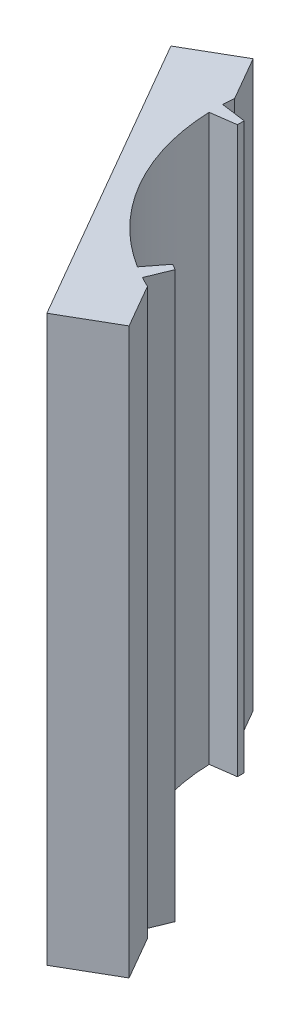
from build123d import *

# Parameters (mm, degrees)
BOSS_EXTRUDE1_DEPTH = 50


with BuildPart() as part:
    # Sketch1 → Boss-Extrude1 (new body)
    with BuildSketch(Plane(origin=(0, 0, 0), x_dir=(1, 0, 0), z_dir=(0, 1, 0))):
        with BuildLine():
            Line((-16.188252967, -0.3), (-16.188252967, 0.3))
            Line((-16.188252967, 0.3), (-18.390214789, 0.6))
            ThreePointArc((-18.390214789, 0.6), (-18.366950287, 1.102332591), (-18.329967032, 1.603841822))
            Line((-18.329967032, 1.603841822), (-20.552991394, 5.454232962))
            Line((-20.552991394, 5.454232962), (-25.166918237, 2.790381057))
            Line((-25.166918237, 2.790381057), (-10.166918237, -23.190381057))
            Line((-10.166918237, -23.190381057), (-5.552991394, -20.526529152))
            Line((-5.552991394, -20.526529152), (-7.776015755, -16.676138011))
            ThreePointArc((-7.776015755, -16.676138011), (-8.228827116, -16.457411834), (-8.675492152, -16.226393189))
            Line((-8.675492152, -16.226393189), (-7.834318863, -14.169438313))
            Line((-7.834318863, -14.169438313), (-8.353934105, -13.869438313))
            Line((-8.353934105, -13.869438313), (-9.714722637, -15.626393189))
            ThreePointArc((-9.714722637, -15.626393189), (-15.93486743, -9.2), (-18.390214789, -0.6))
            Line((-18.390214789, -0.6), (-16.188252967, -0.3))
        make_face()
    extrude(amount=BOSS_EXTRUDE1_DEPTH)


solid = part.part
